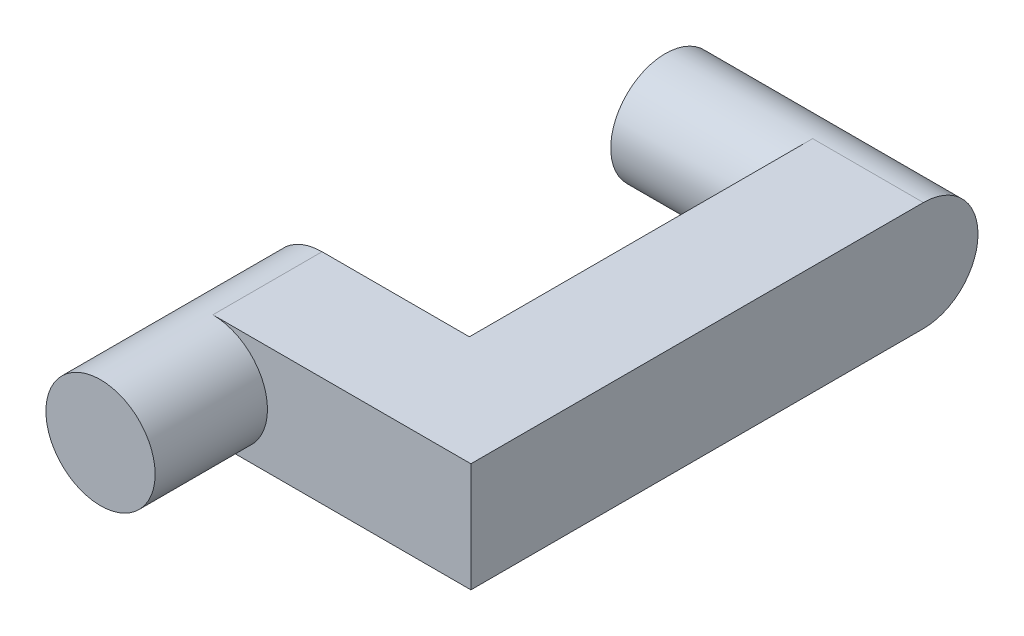
from build123d import *

# Parameters (mm, degrees)
BOSS_EXTRUDE1_DEPTH             = 35
BOSS_EXTRUDE4_REACH             = 109.487
SKETCH4_R                       = 17.5
BOSS_EXTRUDE4_DIRECTION_2_REACH = 109.487
BOSS_EXTRUDE3_DEPTH             = 36
BOSS_EXTRUDE3_DEPTH_BACK        = 35
SKETCH3_R                       = 17.5


with BuildPart() as part:
    # Sketch1 → Boss-Extrude1 (new body)
    with BuildSketch(Plane(origin=(0, 0, 0), x_dir=(1, 0, 0), z_dir=(0, 1, 0))):
        Polygon((0, -90), (82.692132723, -90), (82.692132723, 55), (47.206666819, 55), (47.206666819, -55), (0, -55), align=None)
    extrude(amount=BOSS_EXTRUDE1_DEPTH)


with BuildPart() as body_2:

    # Boss-Extrude4: up to this face of the body (flat: up to its plane)
    boss_extrude4_end = Plane(part.part.faces().sort_by_distance((0, 17.5, 72.5))[0])
    # Sketch4 → Boss-Extrude4 (new, up to the picked face)
    with BuildSketch(Plane.ZY.offset(-47.206666819), mode=Mode.PRIVATE) as boss_extrude4_sk1:
        with Locations(Location((-55, 17.5, 0), (0, 0, 180))):
            Circle(SKETCH4_R)
    boss_extrude4_tool1 = split(extrude(boss_extrude4_sk1.sketch, amount=BOSS_EXTRUDE4_REACH, mode=Mode.PRIVATE), bisect_by=boss_extrude4_end, keep=Keep.BOTH, mode=Mode.PRIVATE)
    add(boss_extrude4_tool1.solids().sort_by(Axis((47.206667, 17.5, -55), (-1, 0, 0)))[0])


    # Boss-Extrude4 direction 2: up to this face of the body (flat: up to its plane)
    boss_extrude4_direction_2_end = Plane(part.part.faces().sort_by_distance((82.692132723, 17.5, 17.5))[0])
    # Sketch4 → Boss-Extrude4 direction 2 (add, up to the picked face)
    with BuildSketch(Plane.ZY.offset(-47.206666819), mode=Mode.PRIVATE) as boss_extrude4_direction_2_sk1:
        with Locations(Location((-55, 17.5, 0), (0, 0, 180))):
            Circle(SKETCH4_R)
    boss_extrude4_direction_2_tool1 = split(extrude(boss_extrude4_direction_2_sk1.sketch, amount=-BOSS_EXTRUDE4_DIRECTION_2_REACH, mode=Mode.PRIVATE), bisect_by=boss_extrude4_direction_2_end, keep=Keep.BOTH, mode=Mode.PRIVATE)
    add(boss_extrude4_direction_2_tool1.solids().sort_by(Axis((47.206667, 17.5, -55), (1, 0, 0)))[0])


with BuildPart() as body_3:
    # Sketch3 → Boss-Extrude3 (new, two sides: drawn at the far end of the back side and taken through both)
    with BuildSketch(Plane.XY.offset(90).offset(-BOSS_EXTRUDE3_DEPTH_BACK)):
        with Locations((0, 17.5)):
            Circle(SKETCH3_R)
    extrude(amount=BOSS_EXTRUDE3_DEPTH + BOSS_EXTRUDE3_DEPTH_BACK)

    # Combine1: union part, body 2
    add(part.part)
    add(body_2.part)


solid = body_3.part
